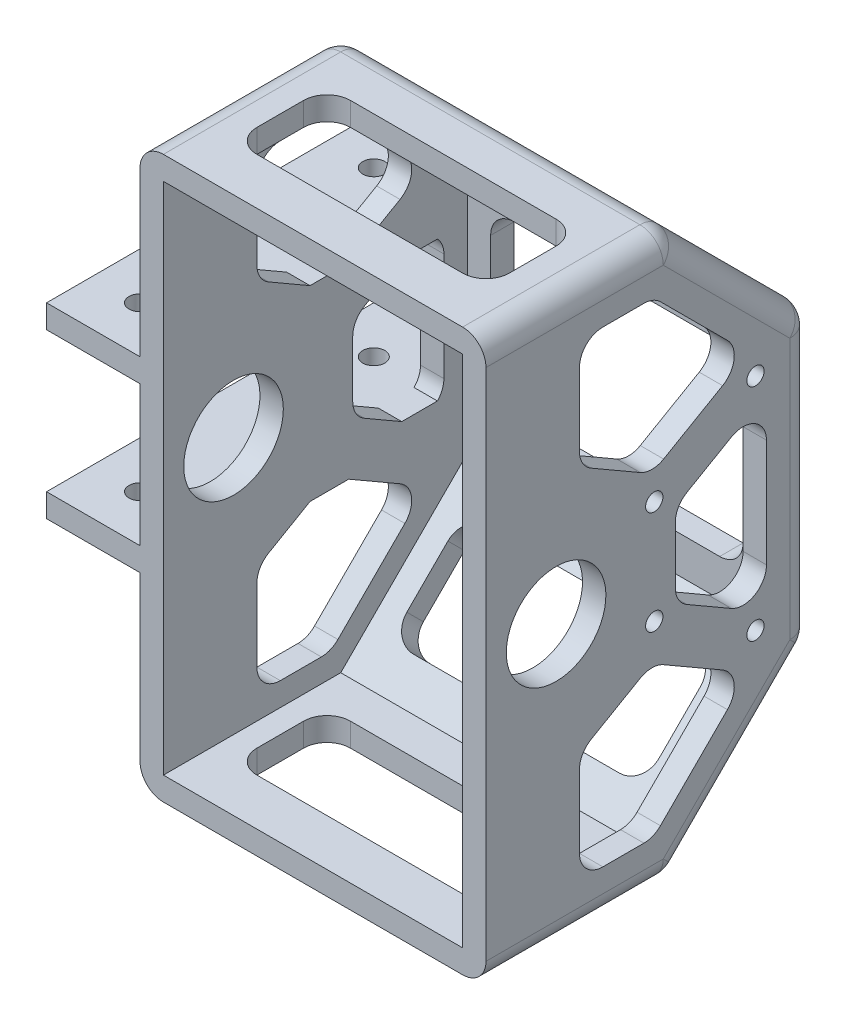
from build123d import *

# Parameters (mm, degrees)
SKETCH_1_W           = 74
SKETCH_1_H           = 120
EXTRUDE_1_DEPTH      = 70
CHAMFER_2_SIZE       = 30
SHELL_1_T            = -5
CUT_EXTRUDE_1_DEPTH  = 119.220133649
SKETCH_3_W           = 54
SKETCH_3_H           = 22.426406871
CUT_EXTRUDE_2_DEPTH  = 70
SKETCH_4_W           = 54
SKETCH_4_H           = 22.426406871
CUT_EXTRUDE_3_DEPTH  = 70
SKETCH_5_W           = 54
SKETCH_5_H           = 40
CUT_EXTRUDE_4_DEPTH  = 70
SKETCH_7_W           = 54
SKETCH_7_H           = 20
CUT_EXTRUDE_5_DEPTH  = 144.767172887
FILLET_1_R           = 5
EXTRUDE_3_DEPTH      = 20
EXTRUDE_3_DEPTH_BACK = 5
SKETCH_10_W          = 70
SKETCH_10_H          = 5
SKETCH_12_R          = 2.35
CUT_EXTRUDE_7_DEPTH  = 121.619235614
SKETCH_13_R          = 1.85
CUT_EXTRUDE_8_DEPTH  = 10


with BuildPart() as part:
    # ｽｹｯﾁ1 → ﾎﾞｽ - 押し出し1 (new body)
    with BuildSketch(Plane.XY):
        Rectangle(SKETCH_1_W, SKETCH_1_H)
    extrude(amount=EXTRUDE_1_DEPTH)

    # 面取り2
    chamfer_2_edges = [part.edges().sort_by_distance(p)[0] for p in [
        (0, -60, 0),
        (0, 60, 0),
    ]]
    chamfer(chamfer_2_edges, length=CHAMFER_2_SIZE)

    # ｼｪﾙ1
    shell_1_openings = [part.faces().sort_by_distance(p)[0] for p in [
        (0, 0, 70),
    ]]
    offset(amount=SHELL_1_T, openings=shell_1_openings, kind=Kind.INTERSECTION)

    # ｽｹｯﾁ2 → ｶｯﾄ - 押し出し1 (cut, through all)
    with BuildSketch(Plane.ZY.offset(37)):
        Polygon((34.142135624, -50), (50, -50), (50, -26.558112383), (34.5, -17.60918321), (13.738168081, -29.596032457), align=None)
        Polygon((10, 20.207259422), (10, -20.207259422), (29.5, -8.948929172), (29.5, 8.948929172), align=None)
        Polygon((34.142135624, 50), (13.738168081, 29.596032457), (34.5, 17.60918321), (50, 26.558112383), (50, 50), align=None)
        with BuildLine():
            ThreePointArc((60, 9.40332388), (44.35, 0), (60, -9.40332388))
            Line((60, -9.40332388), (60, 9.40332388))
        make_face()
        with BuildLine():
            Line((60, 9.40332388), (60, -9.40332388))
            ThreePointArc((60, -9.40332388), (64.128869043, -5.485093436), (65.65, 0))
            ThreePointArc((65.65, 0), (64.128869043, 5.485093436), (60, 9.40332388))
        make_face()
    extrude(amount=-CUT_EXTRUDE_1_DEPTH, mode=Mode.SUBTRACT)

    # ｽｹｯﾁ3 → ｶｯﾄ - 押し出し2 (cut)
    with BuildSketch(Plane(origin=(0, -15, -15), x_dir=(1, 0, 0), z_dir=(0, -0.7071067811865464, -0.7071067811865487))):
        with Locations((0, 42.426406872)):
            Rectangle(SKETCH_3_W, SKETCH_3_H)
    extrude(amount=-CUT_EXTRUDE_2_DEPTH, mode=Mode.SUBTRACT)

    # ｽｹｯﾁ4 → ｶｯﾄ - 押し出し3 (cut)
    with BuildSketch(Plane(origin=(0, 15, -15), x_dir=(1, 0, 0), z_dir=(0, 0.7071067811865464, -0.7071067811865487))):
        with Locations((0, -42.426406872)):
            Rectangle(SKETCH_4_W, SKETCH_4_H)
    extrude(amount=-CUT_EXTRUDE_3_DEPTH, mode=Mode.SUBTRACT)

    # ｽｹｯﾁ5 → ｶｯﾄ - 押し出し4 (cut)
    with BuildSketch(Plane(origin=(0, 0, 0), x_dir=(-1, 0, 0), z_dir=(0, 0, -1))):
        Rectangle(SKETCH_5_W, SKETCH_5_H)
    extrude(amount=-CUT_EXTRUDE_4_DEPTH, mode=Mode.SUBTRACT)

    # ｽｹｯﾁ7 → ｶｯﾄ - 押し出し5 (cut, through all)
    with BuildSketch(Plane(origin=(0, 60, 0), x_dir=(1, 0, 0), z_dir=(0, 1, 0))):
        with Locations((0, -50)):
            Rectangle(SKETCH_7_W, SKETCH_7_H)
    extrude(amount=-CUT_EXTRUDE_5_DEPTH, mode=Mode.SUBTRACT)

    # ﾌｨﾚｯﾄ1
    fillet_1_edges = [part.edges().sort_by_distance(p)[0] for p in [
        (34.5, 20.207259422, 10),
        (34.5, 8.948929172, 29.5),
        (34.5, -8.948929172, 29.5),
        (34.5, -20.207259422, 10),
        (-34.5, 20.207259422, 10),
        (-34.5, 8.948929172, 29.5),
        (-34.5, -8.948929172, 29.5),
        (-34.5, -20.207259422, 10),
        (0, 60, 30),
        (-27, -51.161165235, 24.696699141),
        (27, -51.161165235, 24.696699141),
        (27, -35.303300859, 8.838834765),
        (-27, -35.303300859, 8.838834765),
        (-37, 0, 0),
        (-37, -45, 15),
        (-37, 45, 15),
        (27, 51.161165235, 24.696699141),
        (-27, 51.161165235, 24.696699141),
        (-27, 35.303300859, 8.838834765),
        (27, 35.303300859, 8.838834765),
        (37, 0, 0),
        (0, -30, 0),
        (0, 30, 0),
        (37, -45, 15),
        (-27, -20, 2.5),
        (27, -20, 2.5),
        (27, 20, 2.5),
        (-27, 20, 2.5),
        (37, 45, 15),
        (0, -60, 30),
        (27, 57.5, 60),
        (-27, 57.5, 60),
        (-27, 57.5, 40),
        (27, 57.5, 40),
        (27, -57.5, 60),
        (-27, -57.5, 60),
        (-27, -57.5, 40),
        (27, -57.5, 40),
        (34.5, -50, 34.142135624),
        (34.5, -29.596032457, 13.738168081),
        (34.5, -17.60918321, 34.5),
        (34.5, -26.558112383, 50),
        (34.5, -50, 50),
        (-34.5, -50, 34.142135624),
        (-34.5, -29.596032457, 13.738168081),
        (-34.5, -17.60918321, 34.5),
        (-34.5, -26.558112383, 50),
        (-34.5, -50, 50),
        (37, -60, 50),
        (-37, -60, 50),
        (-37, 60, 50),
        (37, 60, 50),
        (34.5, 50, 34.142135624),
        (34.5, 50, 50),
        (34.5, 26.558112383, 50),
        (34.5, 17.60918321, 34.5),
        (34.5, 29.596032457, 13.738168081),
        (-34.5, 50, 34.142135624),
        (-34.5, 50, 50),
        (-34.5, 26.558112383, 50),
        (-34.5, 17.60918321, 34.5),
        (-34.5, 29.596032457, 13.738168081),
    ]]
    fillet(fillet_1_edges, radius=FILLET_1_R)

    # ｽｹｯﾁ10 → ﾎﾞｽ - 押し出し3 (add, two sides: drawn at the far end of the back side and taken through both)
    with BuildSketch(Plane.ZY.offset(37).offset(-EXTRUDE_3_DEPTH_BACK)):
        with Locations((35, 17.5)):
            Rectangle(SKETCH_10_W, SKETCH_10_H)
        with Locations((35, -17.5)):
            Rectangle(SKETCH_10_W, SKETCH_10_H)
    extrude(amount=EXTRUDE_3_DEPTH + EXTRUDE_3_DEPTH_BACK)

    # ｽｹｯﾁ12 → ｶｯﾄ - 押し出し7 (cut, through all)
    with BuildSketch(Plane.XZ.offset(20)):
        with Locations((-47, 60)):
            Circle(SKETCH_12_R)
        with Locations((-47, 10)):
            Circle(SKETCH_12_R)
    extrude(amount=-CUT_EXTRUDE_7_DEPTH, mode=Mode.SUBTRACT)

    # ｽｹｯﾁ13 → ｶｯﾄ - 押し出し8 (cut)
    with BuildSketch(Plane(origin=(37, 0, 0), x_dir=(0, 0, -1), z_dir=(1, 0, 0))):
        with Locations(Location((-12.349364905, 24.624355653, 0), (0, 0, 90))):
            Circle(SKETCH_13_R)
        with Locations(Location((-34, 12.124355653, 0), (0, 0, 90))):
            Circle(SKETCH_13_R)
        with Locations(Location((-34, -10.011106999, 0), (0, 0, 90))):
            Circle(SKETCH_13_R)
        with Locations(Location((-12.349364905, -22.511106999, 0), (0, 0, 90))):
            Circle(SKETCH_13_R)
    extrude(amount=-CUT_EXTRUDE_8_DEPTH, mode=Mode.SUBTRACT)


solid = part.part
